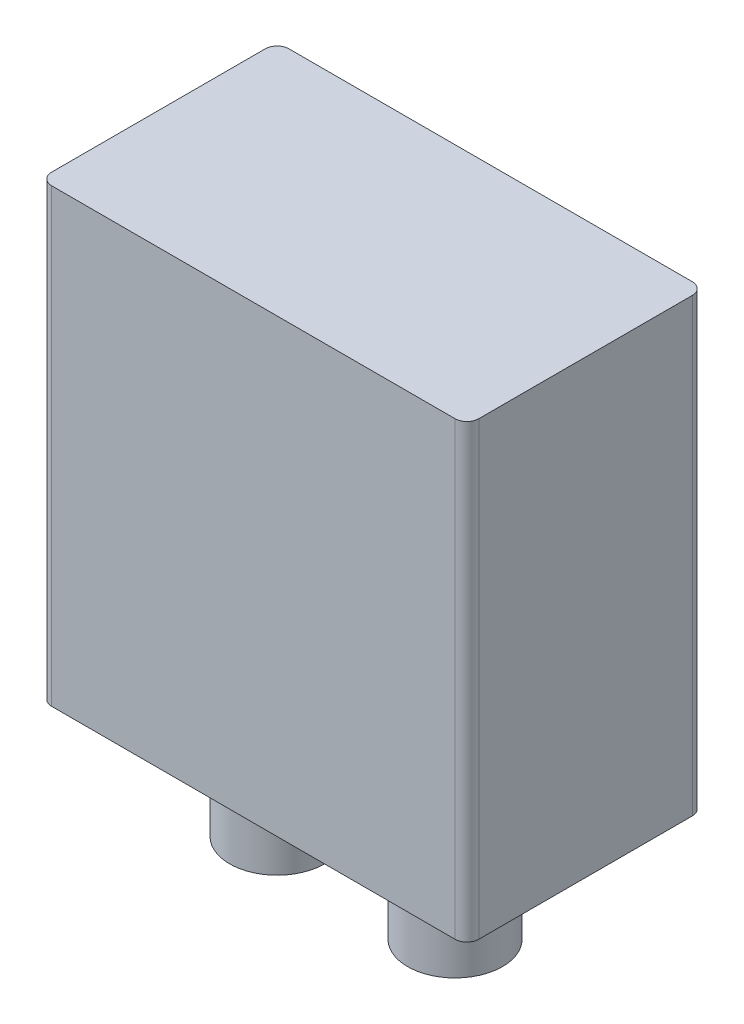
from build123d import *

# Parameters (mm, degrees)
SKETCH1_W             = 36
SKETCH1_H             = 38
BOSS_EXTRUDE1_DEPTH   = 20
FILLET1_R             = 1
SKETCH2_R             = 4
BOSS_EXTRUDE2_DEPTH   = 10
BOSS_EXTRUDE2_2_DEPTH = 10


with BuildPart() as part:
    # Sketch1 → Boss-Extrude1 (new body)
    with BuildSketch(Plane.XY):
        Rectangle(SKETCH1_W, SKETCH1_H)
    extrude(amount=BOSS_EXTRUDE1_DEPTH)

    # Fillet1
    fillet1_edges = [part.edges().sort_by_distance(p)[0] for p in [
        (-18, 0, 20),
        (18, 0, 20),
        (-18, 0, 0),
        (18, 0, 0),
    ]]
    fillet(fillet1_edges, radius=FILLET1_R)


with BuildPart() as body_2:
    # Sketch2 → Boss-Extrude2 (new body)
    with BuildSketch(Plane.XZ.offset(19)):
        with Locations(Location((-8, 10, 0), (0, 0, 270))):
            Circle(SKETCH2_R)
    extrude(amount=BOSS_EXTRUDE2_DEPTH)


with BuildPart() as body_3:
    # Sketch2 → Boss-Extrude2 2 (new body)
    with BuildSketch(Plane.XZ.offset(19)):
        with Locations(Location((7, 10, 0), (0, 0, 270))):
            Circle(SKETCH2_R)
    extrude(amount=BOSS_EXTRUDE2_2_DEPTH)


solid = Compound([part.part, body_2.part, body_3.part])
